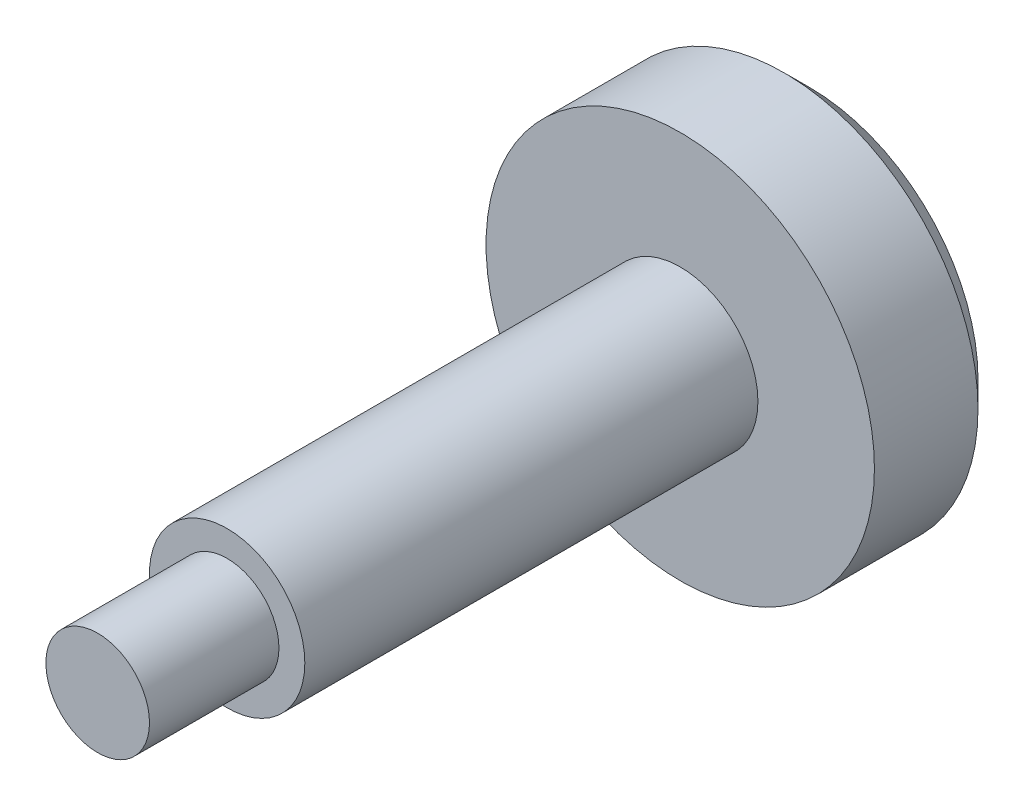
from build123d import *

# Parameters (mm, degrees)
ESBO_O1_R                = 15
RESSALTO_EXTRUS_O1_DEPTH = 10
ESBO_O2_R                = 6
RESSALTO_EXTRUS_O2_DEPTH = 35
ESBO_O3_R                = 4
RESSALTO_EXTRUS_O3_DEPTH = 10
CHANFRO1_SIZE            = 2


with BuildPart() as part:
    # Esboço1 → Ressalto-extrusão1 (new body)
    with BuildSketch(Plane.XY):
        Circle(ESBO_O1_R)
    extrude(amount=RESSALTO_EXTRUS_O1_DEPTH)

    # Esboço2 → Ressalto-extrusão2 (add)
    with BuildSketch(Plane.XY.offset(10)):
        Circle(ESBO_O2_R)
    extrude(amount=RESSALTO_EXTRUS_O2_DEPTH)

    # Esboço3 → Ressalto-extrusão3 (add)
    with BuildSketch(Plane.XY.offset(45)):
        Circle(ESBO_O3_R)
    extrude(amount=RESSALTO_EXTRUS_O3_DEPTH)

    # Chanfro1
    chanfro1_edges = [part.edges().sort_by_distance(p)[0] for p in [
        (-15, 0, 0),
    ]]
    chamfer(chanfro1_edges, length=CHANFRO1_SIZE)


solid = part.part
